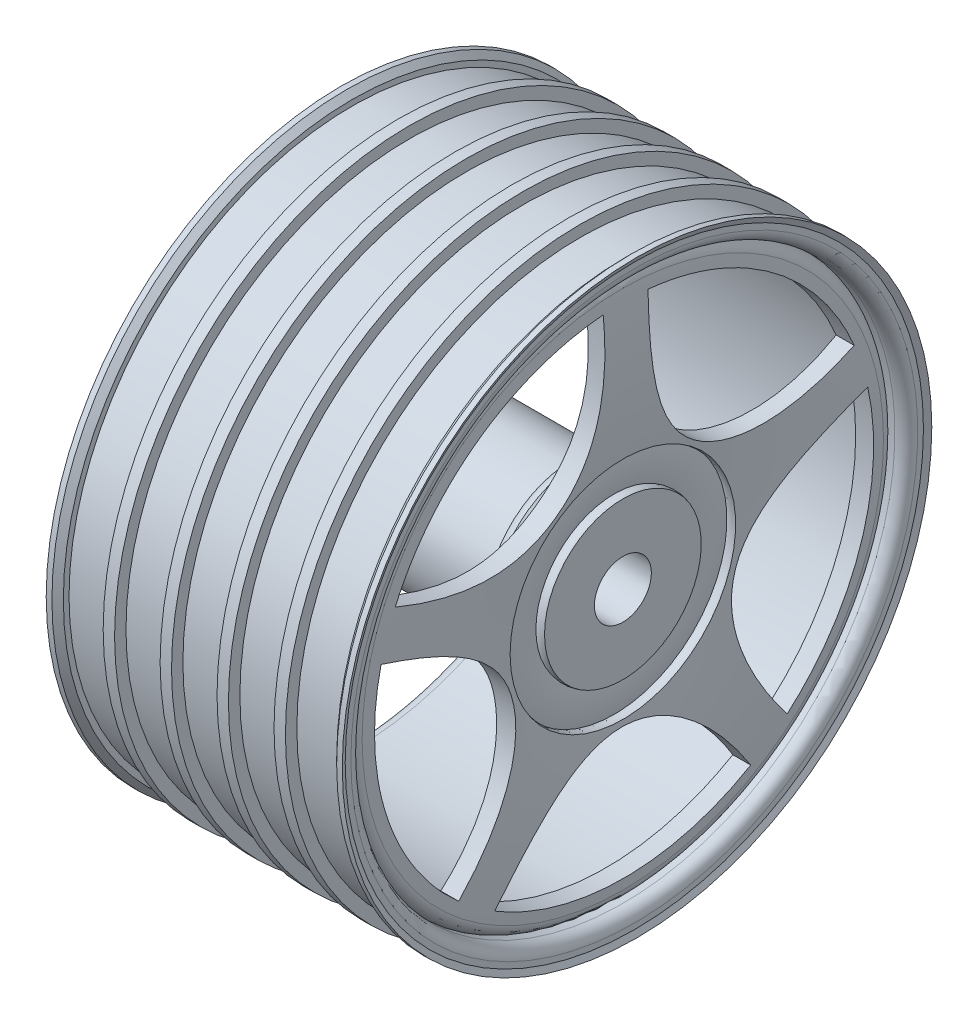
from build123d import *

# Parameters (mm, degrees)
CUT_EXTRUDE_2_DEPTH = 10
SKETCH_12_R         = 2.5
CUT_EXTRUDE_3_DEPTH = 100


with BuildPart() as part:
    # Эскиз10 → Повернуть1 (revolve)
    with BuildSketch(Plane.XY, mode=Mode.PRIVATE) as revolve_1_sk:
        with BuildLine():
            Line((0, 0), (-0.487297077, 0.005936655))
            Line((-0.487297077, 0.005936655), (-0.988217402, -0.497232132))
            Line((-0.988217402, -0.497232132), (-0.988217402, -0.998584824))
            Line((-0.988217402, -0.998584824), (-4.988217402, -0.998584824))
            Line((-4.988217402, -0.998584824), (-4.988217402, 0.004120561))
            Line((-4.988217402, 0.004120561), (-5.988425353, 0.004120561))
            Line((-5.988425353, 0.004120561), (-5.988425353, -0.998584824))
            Line((-5.988425353, -0.998584824), (-9.988425353, -0.998584824))
            Line((-9.988425353, -0.998584824), (-9.995616239, 0))
            Line((-9.995616239, 0), (-10.995824189, 0))
            Line((-10.995824189, 0), (-10.995824189, -1.002705385))
            Line((-10.995824189, -1.002705385), (-14.995824189, -1.002705385))
            Line((-14.995824189, -1.002705385), (-14.991150638, 0.00065957))
            Line((-14.991150638, 0.00065957), (-15.991150638, 0.00065957))
            Line((-15.991150638, 0.00065957), (-15.991150638, -1.002045815))
            Line((-15.991150638, -1.002045815), (-19.991150638, -1.002045815))
            Line((-19.991150638, -1.002045815), (-19.991150638, 0.00065957))
            Line((-19.991150638, 0.00065957), (-20.991150638, 0.00065957))
            Line((-20.991150638, 0.00065957), (-20.991150638, -1.002045815))
            Line((-20.991150638, -1.002045815), (-24.991150638, -1.002045815))
            Line((-24.991150638, -1.002045815), (-24.991150638, -0.502045815))
            Line((-24.991150638, -0.502045815), (-25.493196453, 0))
            Line((-25.493196453, 0), (-25.993196453, 0))
            Line((-25.993196453, 0), (-25.745949738, -0.5))
            Line((-25.745949738, -0.5), (-25.745949738, -1))
            ThreePointArc((-25.745949738, -1), (-25.45305652, -1.707106781), (-24.745949738, -1.999999018))
            Line((-24.745949738, -1.999999018), (-2.75, -1.999999018))
            ThreePointArc((-2.75, -1.999999018), (-2.811376319, -2.999999509), (-2.75, -4))
            ThreePointArc((-2.75, -4), (-2.451794265, -9.800068823), (-2.980093438, -15.583720352))
            Line((-2.980093438, -15.583720352), (-5, -18))
            ThreePointArc((-5, -18), (-5.707106781, -18.292893219), (-6, -19))
            Line((-6, -19), (-24.747351018, -19))
            Line((-24.747351018, -19), (-24.747351018, -23.962178132))
            Line((-24.747351018, -23.962178132), (-14.995824189, -23.962178132))
            Line((-14.995824189, -23.962178132), (-14.995824189, -25.878284026))
            Line((-14.995824189, -25.878284026), (-1.243369034, -25.878284026))
            Line((-1.243369034, -25.878284026), (-1.243369034, -19))
            ThreePointArc((-1.243369034, -19), (-1.621902916, -18.928660165), (-2.000436799, -19))
            ThreePointArc((-2.000436799, -19), (-1.862603729, -17.492508893), (-2, -15.984977912))
            ThreePointArc((-2, -15.984977912), (-1.621054107, -16.052888182), (-1.243369034, -15.978284026))
            ThreePointArc((-1.243369034, -15.978284026), (-0.997713096, -9.484994397), (-1.249804576, -2.991951433))
            ThreePointArc((-1.249804576, -2.991951433), (-1.48600887, -2.390933067), (-2, -2))
            Line((-2, -2), (-1.243369034, -1.993306115))
            ThreePointArc((-1.243369034, -1.993306115), (-0.533057391, -1.703099822), (-0.238278482, -0.994673596))
            Line((-0.238278482, -0.994673596), (-0.238277567, -0.494671769))
            Line((-0.238277567, -0.494671769), (0, 0))
        make_face()
    revolve(revolve_1_sk.sketch.rotate(Axis((-14.995824189, -25.878284026, 0), (1, 0, 0)), 90), axis=Axis((-14.995824189, -25.878284026, 0), (1, 0, 0)))

    # Эскиз11 → Вырез-Вытянуть2 (cut)
    with BuildSketch(Plane(origin=(0, 0, 0), x_dir=(0, 0, -1), z_dir=(1, 0, 0))):
        with BuildLine():
            ThreePointArc((-1.793023414, -4.078836586), (-12.732052302, -8.109933562), (-20.055899203, -17.180400055))
            add(Edge.make_bspline(
                [(-1.793023414, -4.078836586), (-1.508009661, -10.906193798), (-4.311733768, -19.776357502), (-13.766097952, -19.526980014), (-20.055899203, -17.180400055)],
                knots=[0.063205591, 0.063205591, 0.063205591, 0.063205591, 0.515765534, 0.957190353, 0.957190353, 0.957190353, 0.957190353], degree=3))
        make_face()
        with BuildLine():
            ThreePointArc((20.243364392, -17.422924058), (13.029217517, -8.264966824), (2.139498096, -4.102502797))
            add(Edge.make_bspline(
                [(20.243364392, -17.422924058), (13.83823592, -19.803757649), (4.535810532, -19.878288895), (1.851423413, -10.809592349), (2.139498096, -4.102502797)],
                knots=[0.063205591, 0.063205591, 0.063205591, 0.063205591, 0.515765534, 0.957190353, 0.957190353, 0.957190353, 0.957190353], degree=3))
        make_face()
        with BuildLine():
            ThreePointArc((14.362001375, -42.504324079), (20.842442294, -32.813298265), (21.436072466, -21.170287527))
            add(Edge.make_bspline(
                [(14.362001375, -42.504324079), (10.118400524, -37.148402949), (7.172909564, -28.324302088), (14.968231269, -22.968916876), (21.436072466, -21.170287527)],
                knots=[0.063205591, 0.063205591, 0.063205591, 0.063205591, 0.515765534, 0.957190353, 0.957190353, 0.957190353, 0.957190353], degree=3))
        make_face()
        with BuildLine():
            ThreePointArc((-11.309268676, -44.661394306), (-0.089989051, -47.829968201), (11.166613993, -44.796655861))
            add(Edge.make_bspline(
                [(-11.309268676, -44.661394306), (-7.526829765, -38.970419415), (-0.044817904, -33.442293917), (7.457342983, -39.20118038), (11.166613993, -44.796655861)],
                knots=[0.063205591, 0.063205591, 0.063205591, 0.063205591, 0.515765534, 0.957190353, 0.957190353, 0.957190353, 0.957190353], degree=3))
        make_face()
        with BuildLine():
            ThreePointArc((-21.293623084, -20.913137001), (-20.840167866, -32.562449179), (-14.476834759, -42.330769792))
            add(Edge.make_bspline(
                [(-21.293623084, -20.913137001), (-14.712346426, -22.75184222), (-7.142717831, -28.159373629), (-10.30144912, -37.073946412), (-14.476834759, -42.330769792)],
                knots=[0.063205591, 0.063205591, 0.063205591, 0.063205591, 0.515765534, 0.957190353, 0.957190353, 0.957190353, 0.957190353], degree=3))
        make_face()
    extrude(amount=-CUT_EXTRUDE_2_DEPTH, mode=Mode.SUBTRACT)

    # Эскиз12 → Вырез-Вытянуть3 (cut)
    with BuildSketch(Plane(origin=(-1.243369034, 0, 0), x_dir=(0, 0, -1), z_dir=(1, 0, 0))):
        with Locations((0, -25.878284026)):
            Circle(SKETCH_12_R)
    extrude(amount=-CUT_EXTRUDE_3_DEPTH, mode=Mode.SUBTRACT)


solid = part.part
